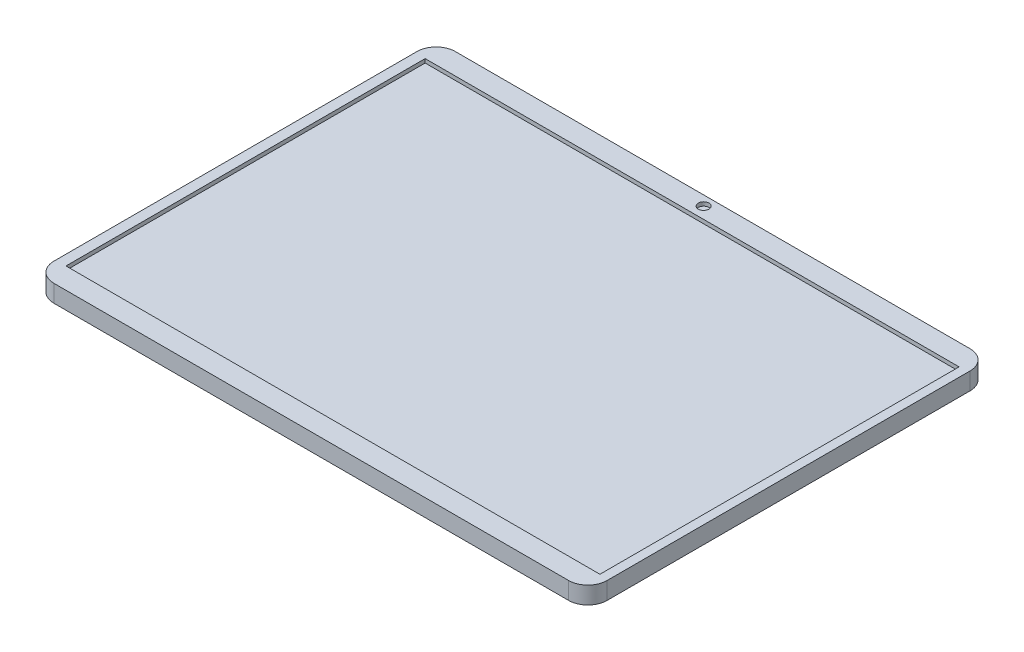
from build123d import *

# Parameters (mm, degrees)
BOSS_EXTRUDE1_DEPTH          = 9
SKETCH2_R                    = 2.766798225
SKETCH2_W                    = 278
SKETCH2_H                    = 187
CUT_EXTRUDE1_DEPTH           = 2
SKETCH4_W                    = 10
SKETCH4_H                    = 4
CUT_EXTRUDE2_DEPTH           = 2
CUT_EXTRUDE2_DRAFT           = -19
CUT_EXTRUDE2_PROFILE_2_DEPTH = 2
CUT_EXTRUDE2_PROFILE_2_DRAFT = -19


with BuildPart() as part:
    # Sketch1 → Boss-Extrude1 (new body)
    with BuildSketch(Plane(origin=(0, 0, 0), x_dir=(1, 0, 0), z_dir=(0, 1, 0))):
        with BuildLine():
            Line((-177.6, 71.8), (90.4, 71.8))
            ThreePointArc((90.4, 71.8), (97.471067812, 68.871067812), (100.4, 61.8))
            Line((100.4, 61.8), (100.4, -127.2))
            ThreePointArc((100.4, -127.2), (97.471067812, -134.271067812), (90.4, -137.2))
            Line((90.4, -137.2), (-177.6, -137.2))
            ThreePointArc((-177.6, -137.2), (-184.671067812, -134.271067812), (-187.6, -127.2))
            Line((-187.6, -127.2), (-187.6, 61.8))
            ThreePointArc((-187.6, 61.8), (-184.671067812, 68.871067812), (-177.6, 71.8))
        make_face()
    extrude(amount=BOSS_EXTRUDE1_DEPTH)

    # Sketch2 → Cut-Extrude1 (cut)
    with BuildSketch(Plane(origin=(0, 9, 0), x_dir=(1, 0, 0), z_dir=(0, 1, 0))):
        with Locations(Location((-43.280764326, 66.757707022, 0), (0, 0, 270))):
            Circle(SKETCH2_R)
        with Locations((-43.280764326, -32.742292978)):
            Rectangle(SKETCH2_W, SKETCH2_H)
    extrude(amount=-CUT_EXTRUDE1_DEPTH, mode=Mode.SUBTRACT)


with BuildPart() as cut_extrude2_tool:
    # Sketch4 → Cut-Extrude2 (with draft: the straight prism first)
    with BuildSketch(Plane.ZY.offset(187.6)):
        with Locations((-11.8, 4.5)):
            Rectangle(SKETCH4_W, SKETCH4_H)
    extrude(amount=-CUT_EXTRUDE2_DEPTH)
    # Cut-Extrude2: the draft: its side faces are tilted about the plane it starts from
    cut_extrude2_sides = [cut_extrude2_tool.faces().sort_by_distance(p)[0] for p in [
        (-186.6, 6.5, -11.8),
        (-186.6, 4.5, -16.8),
        (-186.6, 2.5, -11.8),
        (-186.6, 4.5, -6.8),
    ]]
    draft(cut_extrude2_sides, Plane.ZY.offset(187.6), CUT_EXTRUDE2_DRAFT)


with BuildPart() as part_1:
    add(part.part)

    # Cut-Extrude2: cut by cut_extrude2_tool
    add(cut_extrude2_tool.part, mode=Mode.SUBTRACT)


with BuildPart() as cut_extrude2_profile_2_tool:
    # Sketch4 → Cut-Extrude2 profile 2 (with draft: the straight prism first)
    with BuildSketch(Plane.ZY.offset(187.6)):
        with Locations((18.2, 4.5)):
            Rectangle(SKETCH4_W, SKETCH4_H)
    extrude(amount=-CUT_EXTRUDE2_PROFILE_2_DEPTH)
    # Cut-Extrude2 profile 2: the draft: its side faces are tilted about the plane it starts from
    cut_extrude2_profile_2_sides = [cut_extrude2_profile_2_tool.faces().sort_by_distance(p)[0] for p in [
        (-186.6, 2.5, 18.2),
        (-186.6, 4.5, 23.2),
        (-186.6, 6.5, 18.2),
        (-186.6, 4.5, 13.2),
    ]]
    draft(cut_extrude2_profile_2_sides, Plane.ZY.offset(187.6), CUT_EXTRUDE2_PROFILE_2_DRAFT)


with BuildPart() as part_2:
    add(part_1.part)

    # Cut-Extrude2 profile 2: cut by cut_extrude2_profile_2_tool
    add(cut_extrude2_profile_2_tool.part, mode=Mode.SUBTRACT)


solid = part_2.part
